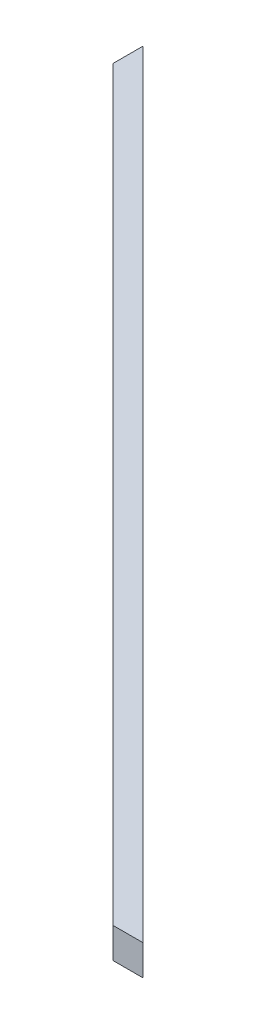
from build123d import *

# Parameters (mm, degrees)
BOSS_EXTRUDE1_DEPTH = 20


with BuildPart() as part:
    # Sketch1 → Boss-Extrude1 (new body)
    with BuildSketch(Plane(origin=(0, 0, 0), x_dir=(1, 0, 0), z_dir=(0, 1, 0))):
        Polygon((-250, 240), (240, -250), (260, -250), (-250, 260), align=None)
    extrude(amount=BOSS_EXTRUDE1_DEPTH)


solid = part.part
